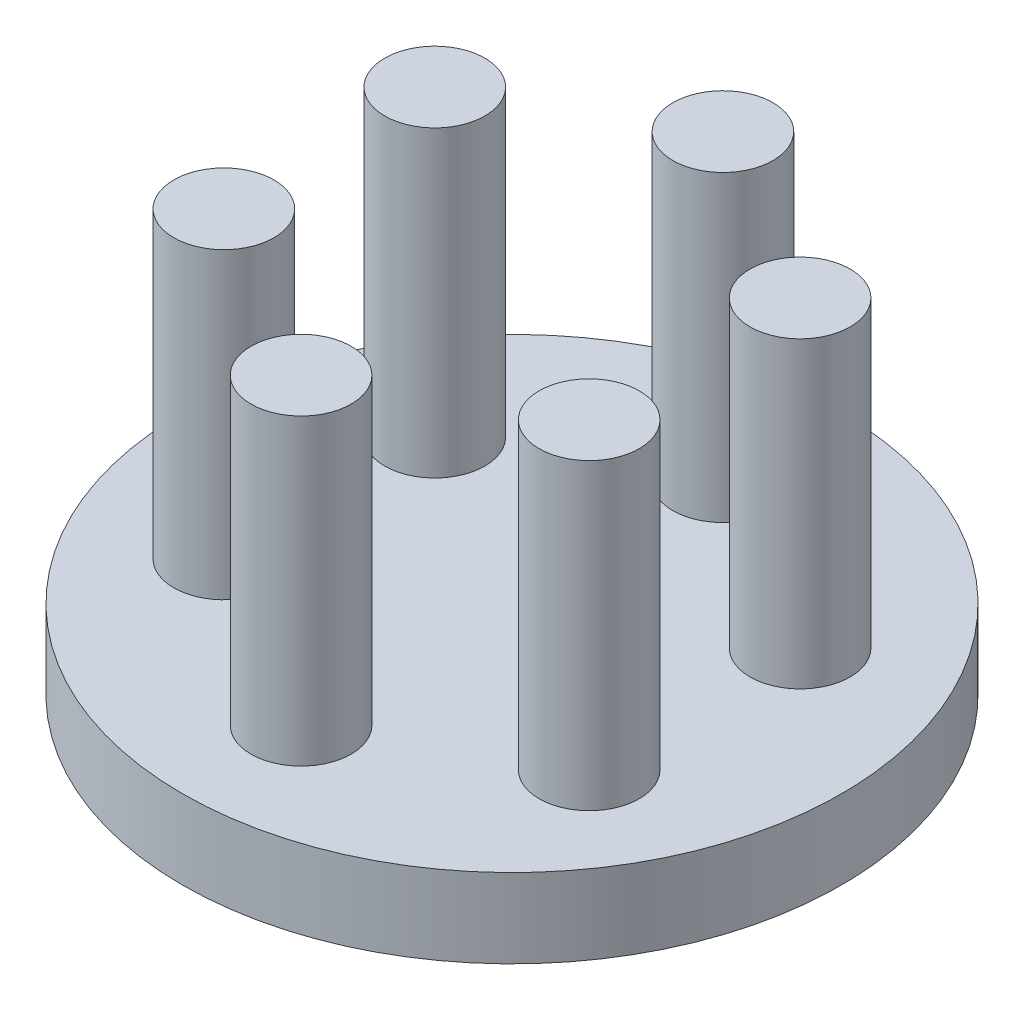
from build123d import *

# Parameters (mm, degrees)
SKETCH_2_R      = 12.5
EXTRUDE_1_DEPTH = 3
SKETCH_3_R      = 1.9
EXTRUDE_2_DEPTH = 11.5


with BuildPart() as part:
    # 草图2 → 凸台-拉伸1 (new body)
    with BuildSketch(Plane(origin=(0, 0, 0), x_dir=(1, 0, 0), z_dir=(0, 1, 0))):
        with Locations(Location((0, 0, 0), (0, 0, 270))):
            Circle(SKETCH_2_R)
    extrude(amount=EXTRUDE_1_DEPTH)

    # 草图3 → 凸台-拉伸2 (add)
    with BuildSketch(Plane(origin=(0, 3, 0), x_dir=(1, 0, 0), z_dir=(0, 1, 0))):
        with Locations(Location((0, 8, 0), (0, 0, 270))):
            Circle(SKETCH_3_R)
        with Locations(Location((6.92820323, 4, 0), (0, 0, 270))):
            Circle(SKETCH_3_R)
        with Locations(Location((6.92820323, -4, 0), (0, 0, 270))):
            Circle(SKETCH_3_R)
        with Locations(Location((0, -8, 0), (0, 0, 270))):
            Circle(SKETCH_3_R)
        with Locations(Location((-6.92820323, -4, 0), (0, 0, 270))):
            Circle(SKETCH_3_R)
        with Locations(Location((-6.92820323, 4, 0), (0, 0, 270))):
            Circle(SKETCH_3_R)
    extrude(amount=EXTRUDE_2_DEPTH)


solid = part.part
